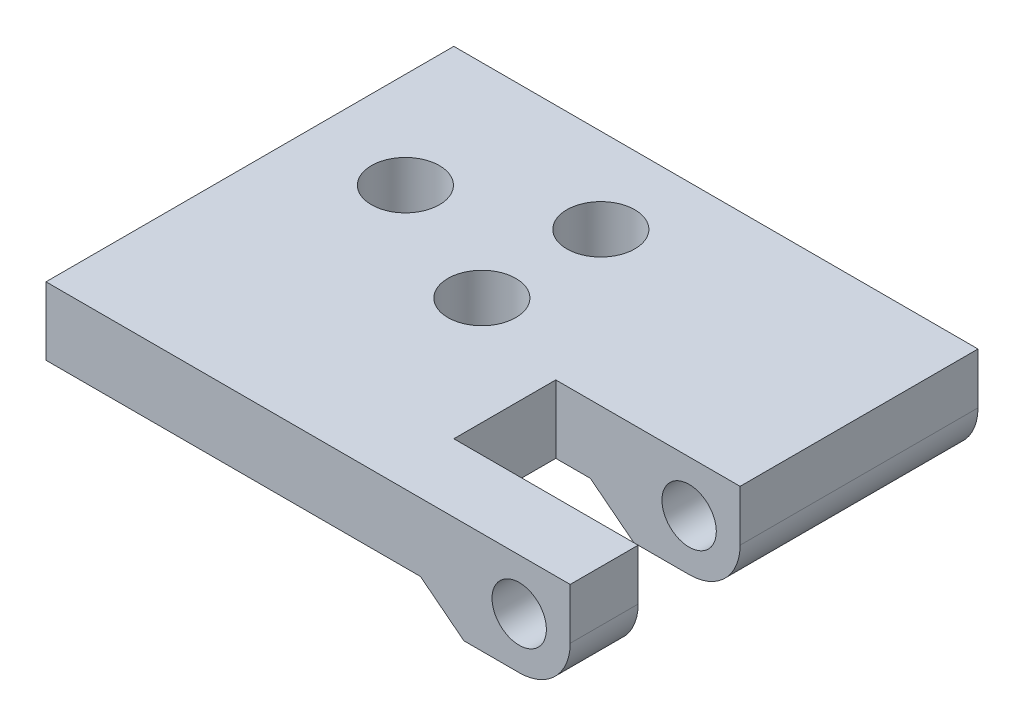
from build123d import *

# Parameters (mm, degrees)
SKETCH_1_R          = 2
EXTRUDE_2_DEPTH     = 6
SKETCH_2_R          = 1.6
CUT_EXTRUDE_2_DEPTH = 26
SKETCH_3_W          = 22.036316786
SKETCH_3_H          = 24
CUT_EXTRUDE_3_DEPTH = 2
CUT_EXTRUDE_4_DEPTH = 27
CUT_EXTRUDE_7_DEPTH = 24
EXTRUDE_4_DEPTH     = 24
SKETCH_9_W          = 6
SKETCH_9_H          = 5.089389346
CUT_EXTRUDE_8_DEPTH = 24


with BuildPart() as part:
    # 草图1 → 凸台-拉伸2 (new body)
    with BuildSketch(Plane(origin=(0, 0, 0), x_dir=(1, 0, 0), z_dir=(0, 1, 0))):
        Polygon((4.305555556, 9.700757576), (-25.694444444, 9.700757576), (-25.694444444, -14.299242424), (4.305555556, -14.299242424), (4.305555556, -10.299242424), (-5.694444444, -10.299242424), (-5.694444444, -4.299242424), (4.305555556, -4.299242424), align=None)
        with Locations(Location((-12.043257461, -2.299242424, 0), (0, 0, 270))):
            Circle(SKETCH_1_R, mode=Mode.SUBTRACT)
        with Locations(Location((-20.043257461, 1.200757576, 0), (0, 0, 270))):
            Circle(SKETCH_1_R, mode=Mode.SUBTRACT)
        with Locations(Location((-12.043257461, 4.700757576, 0), (0, 0, 270))):
            Circle(SKETCH_1_R, mode=Mode.SUBTRACT)
    extrude(amount=EXTRUDE_2_DEPTH)

    # 草图2 → 切除-拉伸2 (cut)
    with BuildSketch(Plane.XY.offset(14.299242424)):
        with Locations((2.152777778, 3)):
            Circle(SKETCH_2_R)
    extrude(amount=-CUT_EXTRUDE_2_DEPTH, mode=Mode.SUBTRACT)

    # 草图3 → 切除-拉伸3 (cut)
    with BuildSketch(Plane.XZ):
        with Locations((-14.676286051, 2.299242424)):
            Rectangle(SKETCH_3_W, SKETCH_3_H)
    extrude(amount=-CUT_EXTRUDE_3_DEPTH, mode=Mode.SUBTRACT)

    # 草图4 → 切除-拉伸4 (cut)
    with BuildSketch(Plane.XY.offset(14.299242424)):
        Polygon((-1.100112358, 0), (-3.658127658, 2), (-3.658127658, 0), align=None)
    extrude(amount=-CUT_EXTRUDE_4_DEPTH, mode=Mode.SUBTRACT)

    # 草图5 → 切除-拉伸7 (cut)
    with BuildSketch(Plane(origin=(0, 0, -9.700757576), x_dir=(-1, 0, 0), z_dir=(0, 0, -1))):
        with BuildLine():
            Line((-2.152777778, 0), (-4.305555556, 0))
            Line((-4.305555556, 0), (-4.305555556, 0.910610654))
            ThreePointArc((-4.305555556, 0.910610654), (-3.32150186, 0.237015378), (-2.152777778, 0))
        make_face()
    extrude(amount=-CUT_EXTRUDE_7_DEPTH, mode=Mode.SUBTRACT)

    # 草图8 → 凸台-拉伸4 (add)
    with BuildSketch(Plane(origin=(0, 0, -9.700757576), x_dir=(-1, 0, 0), z_dir=(0, 0, -1))):
        with BuildLine():
            ThreePointArc((-4.305555556, 0.910610654), (-4.932915664, 1.872687562), (-5.152777778, 3))
            Line((-5.152777778, 3), (-5.152777778, 6))
            Line((-5.152777778, 6), (-4.305555556, 6))
            Line((-4.305555556, 6), (-4.305555556, 0.910610654))
        make_face()
    extrude(amount=-EXTRUDE_4_DEPTH)

    # 草图9 → 切除-拉伸8 (cut)
    with BuildSketch(Plane.ZY.offset(-4.305555556)):
        with Locations((7.299242424, 3.455305327)):
            Rectangle(SKETCH_9_W, SKETCH_9_H)
    extrude(amount=-CUT_EXTRUDE_8_DEPTH, mode=Mode.SUBTRACT)


solid = part.part
